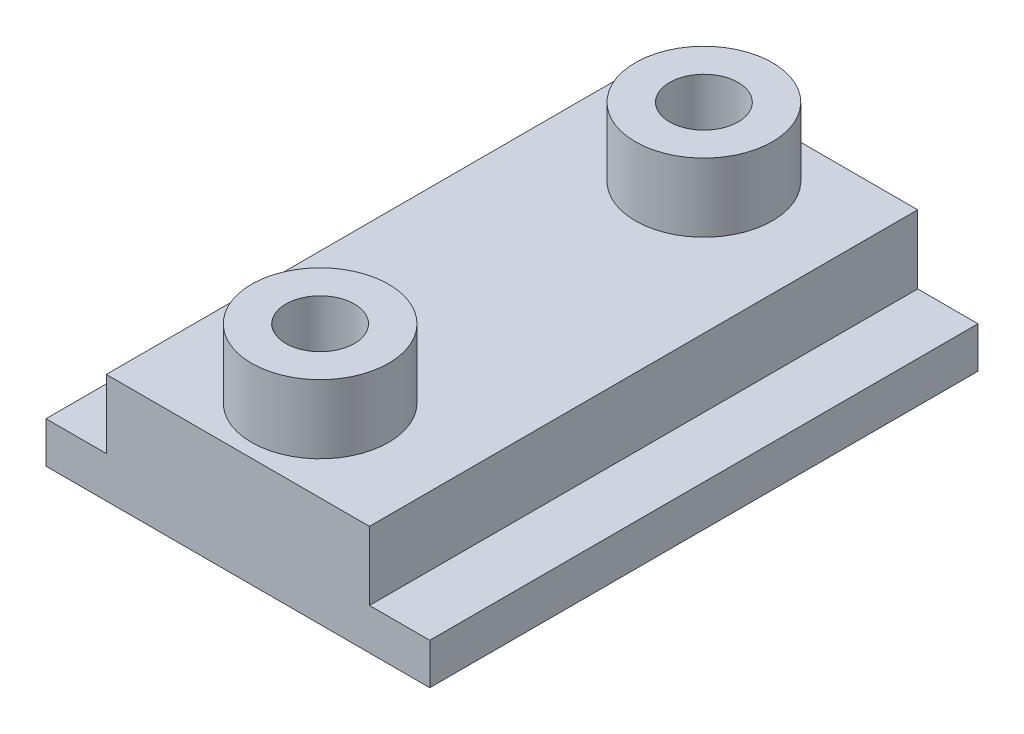
from build123d import *

# Parameters (mm, degrees)
AUFSATZ_LINEAR_AUSTRAGEN1_DEPTH      = 10
AUFSATZ_LINEAR_AUSTRAGEN1_DEPTH_BACK = 10
SKIZZE2_R                            = 2.5
AUFSATZ_LINEAR_AUSTRAGEN2_DEPTH      = 2.5
M3_GEWINDEBOHRUNG1_D                 = 2.5


with BuildPart() as part:
    # Skizze1 → Aufsatz-Linear austragen1 (new, two sides: drawn at the far end of the back side and taken through both)
    with BuildSketch(Plane.XY.offset(-AUFSATZ_LINEAR_AUSTRAGEN1_DEPTH_BACK)):
        Polygon((-7, 0), (7, 0), (7, 1.5), (4.8, 1.5), (4.8, 4), (-4.8, 4), (-4.8, 1.5), (-7, 1.5), align=None)
    extrude(amount=AUFSATZ_LINEAR_AUSTRAGEN1_DEPTH + AUFSATZ_LINEAR_AUSTRAGEN1_DEPTH_BACK)

    # Skizze2 → Aufsatz-Linear austragen2 (add)
    with BuildSketch(Plane(origin=(0, 4, 0), x_dir=(1, 0, 0), z_dir=(0, 1, 0))):
        with Locations((0, 7)):
            Circle(SKIZZE2_R)
        with Locations((0, -7)):
            Circle(SKIZZE2_R)
    extrude(amount=AUFSATZ_LINEAR_AUSTRAGEN2_DEPTH)

    # M3 Gewindebohrung1 (through all)
    with Locations(Plane(origin=(0, 6.5, 0), x_dir=(1, 0, 0), z_dir=(0, 1, 0))):
        with Locations((0, -7), (0, 7)):
            Hole(M3_GEWINDEBOHRUNG1_D / 2)


solid = part.part
